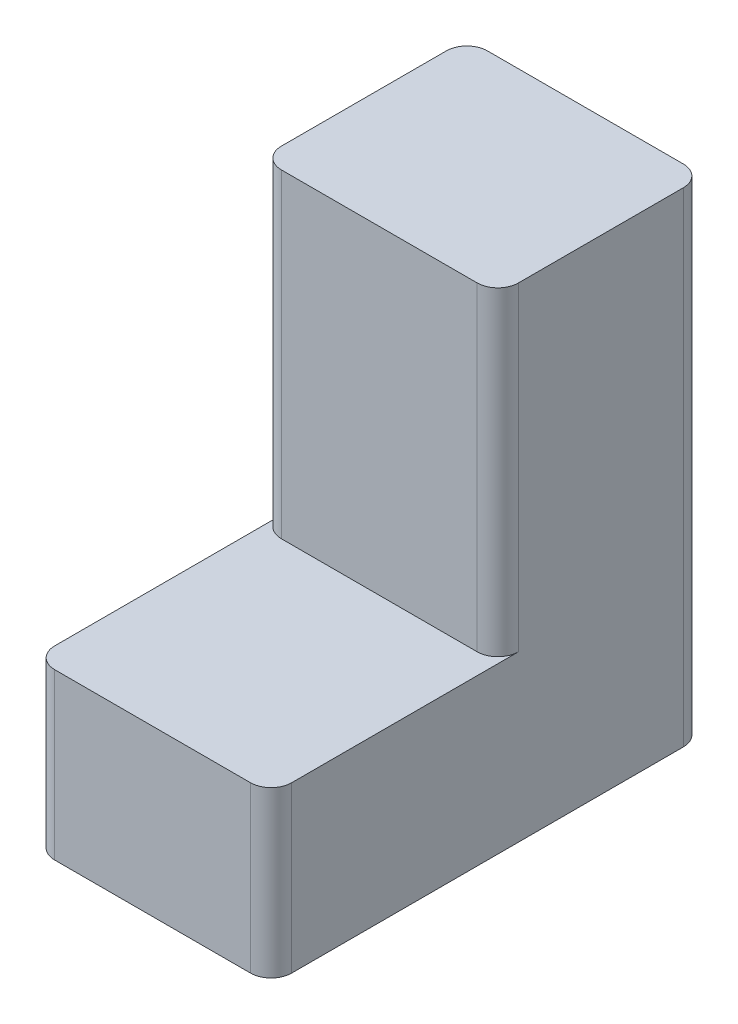
from build123d import *

# Parameters (mm, degrees)
BOSS_EXTRUDE1_DEPTH = 23
SKETCH2_R           = 3.5
BOSS_EXTRUDE2_DEPTH = 6
FILLET3_R           = 2
FILLET4_R           = 2
FILLET5_R           = 2
FILLET6_R           = 2
FILLET7_R           = 2
FILLET8_R           = 2
CUT_EXTRUDE2_START  = -6
CUT_EXTRUDE2_DEPTH  = 6


with BuildPart() as part:
    # Sketch1 → Boss-Extrude1 (new body)
    with BuildSketch(Plane(origin=(0, 0, 0), x_dir=(0, 0, -1), z_dir=(1, 0, 0))):
        Polygon((0, 0), (0, 16), (22, 16), (22, 47), (42, 47), (42, 0), align=None)
    extrude(amount=BOSS_EXTRUDE1_DEPTH)

    # Sketch2 → Boss-Extrude2 (add)
    with BuildSketch(Plane(origin=(0, 0, 0), x_dir=(-1, 0, 0), z_dir=(0, -1, 0))):
        with Locations(Location((-11.5, 10.5, 0), (0, 0, 270))):
            Circle(SKETCH2_R)
    extrude(amount=BOSS_EXTRUDE2_DEPTH)

    # Fillet3
    fillet3_edges = [part.edges().sort_by_distance(p)[0] for p in [
        (23, 8, 0),
    ]]
    fillet(fillet3_edges, radius=FILLET3_R)

    # Fillet4
    fillet4_edges = [part.edges().sort_by_distance(p)[0] for p in [
        (0, 8, 0),
    ]]
    fillet(fillet4_edges, radius=FILLET4_R)

    # Fillet5
    fillet5_edges = [part.edges().sort_by_distance(p)[0] for p in [
        (23, 23.5, -42),
    ]]
    fillet(fillet5_edges, radius=FILLET5_R)

    # Fillet6
    fillet6_edges = [part.edges().sort_by_distance(p)[0] for p in [
        (0, 23.5, -42),
    ]]
    fillet(fillet6_edges, radius=FILLET6_R)

    # Fillet7
    fillet7_edges = [part.edges().sort_by_distance(p)[0] for p in [
        (0, 31.5, -22),
    ]]
    fillet(fillet7_edges, radius=FILLET7_R)

    # Fillet8
    fillet8_edges = [part.edges().sort_by_distance(p)[0] for p in [
        (23, 31.5, -22),
    ]]
    fillet(fillet8_edges, radius=FILLET8_R)

    # Sketch3 → Cut-Extrude2 (cut)
    with BuildSketch(Plane.XZ.offset(6).offset(CUT_EXTRUDE2_START)):
        with BuildLine():
            Line((9.050510257, -13), (13.949489743, -13))
            ThreePointArc((13.949489743, -13), (11.5, -14), (9.050510257, -13))
        make_face()
        with BuildLine():
            Line((9.050510257, -8), (13.949489743, -8))
            ThreePointArc((13.949489743, -8), (11.5, -7), (9.050510257, -8))
        make_face()
    extrude(amount=CUT_EXTRUDE2_DEPTH, mode=Mode.SUBTRACT)


solid = part.part
